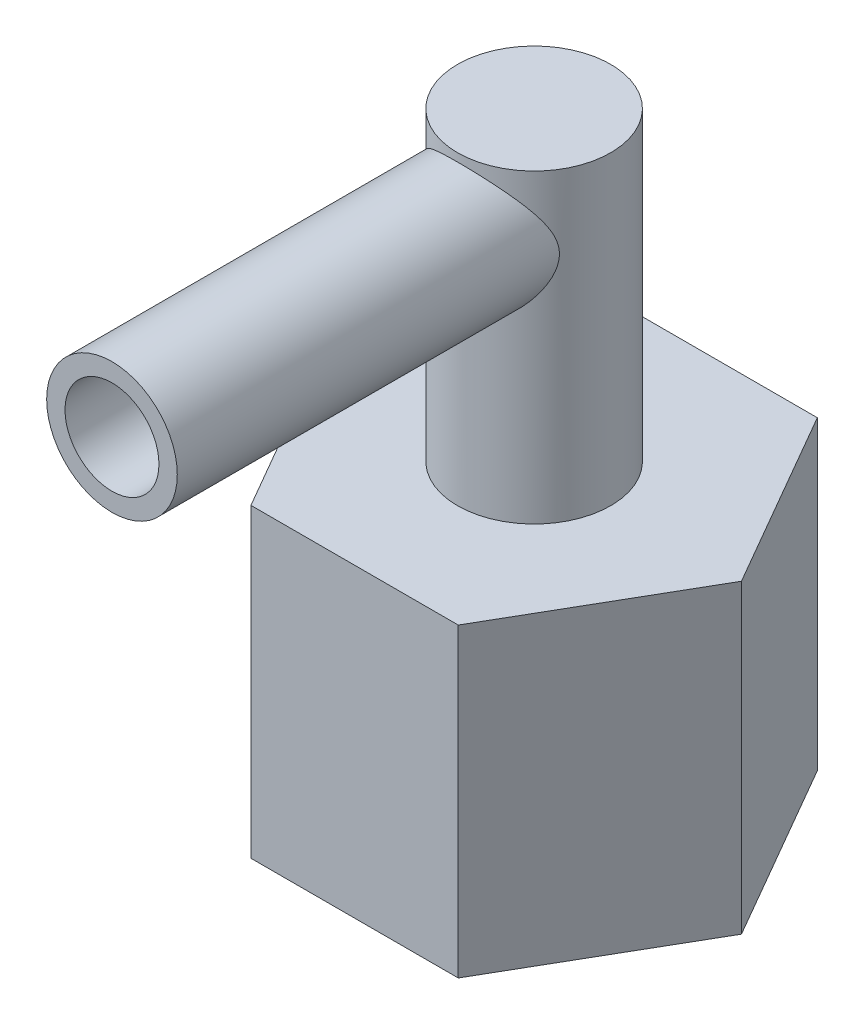
from build123d import *

# Parameters (mm, degrees)
SKETCH1_R           = 4.7625
SKETCH1_R_2         = 3.175
BOSS_EXTRUDE1_DEPTH = 8.3312
BOSS_EXTRUDE2_DEPTH = 8.3312
SKETCH3_R           = 2.0875
SKETCH3_R_2         = 1.5875
BOSS_EXTRUDE3_DEPTH = 8.3312
SKETCH4_R           = 2.0875
BOSS_EXTRUDE4_DEPTH = 0.001
SKETCH5_R           = 1.78
SKETCH5_R_2         = 1.28
BOSS_EXTRUDE5_DEPTH = 11.5062
SKETCH6_R           = 10.258070852
CUT_EXTRUDE1_DEPTH  = 8.3312


with BuildPart() as part:
    # Sketch1 → Boss-Extrude1 (new body)
    with BuildSketch(Plane(origin=(0, 0, 0), x_dir=(1, 0, 0), z_dir=(0, 1, 0))):
        with Locations(Location((0, 0, 0), (0, 0, 270))):
            Circle(SKETCH1_R)
        with Locations(Location((0, 0, 0), (0, 0, 270))):
            Circle(SKETCH1_R_2, mode=Mode.SUBTRACT)
    extrude(amount=BOSS_EXTRUDE1_DEPTH)

    # Sketch2 → Boss-Extrude2 (add)
    with BuildSketch(Plane(origin=(0, 8.3312, 0), x_dir=(1, 0, 0), z_dir=(0, 1, 0))):
        Polygon((5.65061043, 0), (2.825305215, 4.893572179), (-2.825305215, 4.893572179), (-5.65061043, 0), (-2.825305215, -4.893572179), (2.825305215, -4.893572179), align=None)
    extrude(amount=BOSS_EXTRUDE2_DEPTH)

    # Sketch3 → Boss-Extrude3 (add)
    with BuildSketch(Plane(origin=(0, 16.6624, 0), x_dir=(1, 0, 0), z_dir=(0, 1, 0))):
        with Locations(Location((0, 0, 0), (0, 0, 270))):
            Circle(SKETCH3_R)
        with Locations(Location((0, 0, 0), (0, 0, 270))):
            Circle(SKETCH3_R_2, mode=Mode.SUBTRACT)
    extrude(amount=BOSS_EXTRUDE3_DEPTH)

    # Sketch4 → Boss-Extrude4 (add)
    with BuildSketch(Plane(origin=(0, 24.9936, 0), x_dir=(1, 0, 0), z_dir=(0, 1, 0))):
        with Locations(Location((0, 0, 0), (0, 0, 270))):
            Circle(SKETCH4_R)
    extrude(amount=BOSS_EXTRUDE4_DEPTH)

    # Sketch5 → Boss-Extrude5 (add)
    with BuildSketch(Plane.XY):
        with Locations(Location((0, 22.9946, 0), (0, 0, 180))):
            Circle(SKETCH5_R)
        with Locations(Location((0, 22.9946, 0), (0, 0, 180))):
            Circle(SKETCH5_R_2, mode=Mode.SUBTRACT)
    extrude(amount=BOSS_EXTRUDE5_DEPTH)

    # Sketch6 → Cut-Extrude1 (cut)
    with BuildSketch(Plane.XZ):
        Circle(SKETCH6_R)
    extrude(amount=-CUT_EXTRUDE1_DEPTH, mode=Mode.SUBTRACT)


solid = part.part
